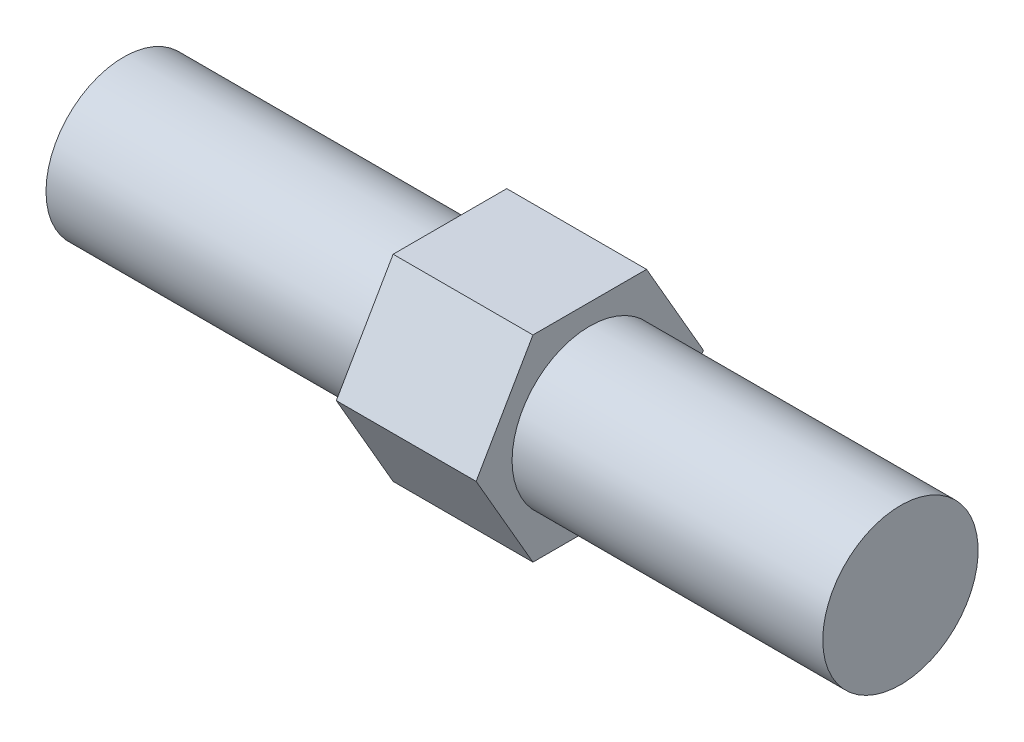
from build123d import *

# Parameters (mm, degrees)
SKETCH1_W                = 15
SKETCH1_H                = 1.5
BOSS_EXTRUDE1_DEPTH      = 1.5
BOSS_EXTRUDE1_DEPTH_BACK = 1.2


with BuildPart() as part:
    # Sketch1 → Revolve1 (revolve)
    with BuildSketch(Plane(origin=(0, 0, 0), x_dir=(1, 0, 0), z_dir=(0, 1, 0)), mode=Mode.PRIVATE) as revolve1_sk:
        with Locations((0, 0.75)):
            Rectangle(SKETCH1_W, SKETCH1_H)
    revolve(revolve1_sk.sketch.rotate(Axis((-19.553100844, 0, 0), (1, 0, 0)), 180), axis=Axis((-19.553100844, 0, 0), (1, 0, 0)))

    # Sketch2 → Boss-Extrude1 (add, two sides: drawn at the far end of the back side and taken through both)
    with BuildSketch(Plane(origin=(0, 0, 0), x_dir=(0, 0, -1), z_dir=(1, 0, 0)).offset(-BOSS_EXTRUDE1_DEPTH_BACK)):
        Polygon((2.193931023, 0), (1.096965511, 1.9), (-1.096965511, 1.9), (-2.193931023, 0), (-1.096965511, -1.9), (1.096965511, -1.9), align=None)
    extrude(amount=BOSS_EXTRUDE1_DEPTH + BOSS_EXTRUDE1_DEPTH_BACK)


solid = part.part
